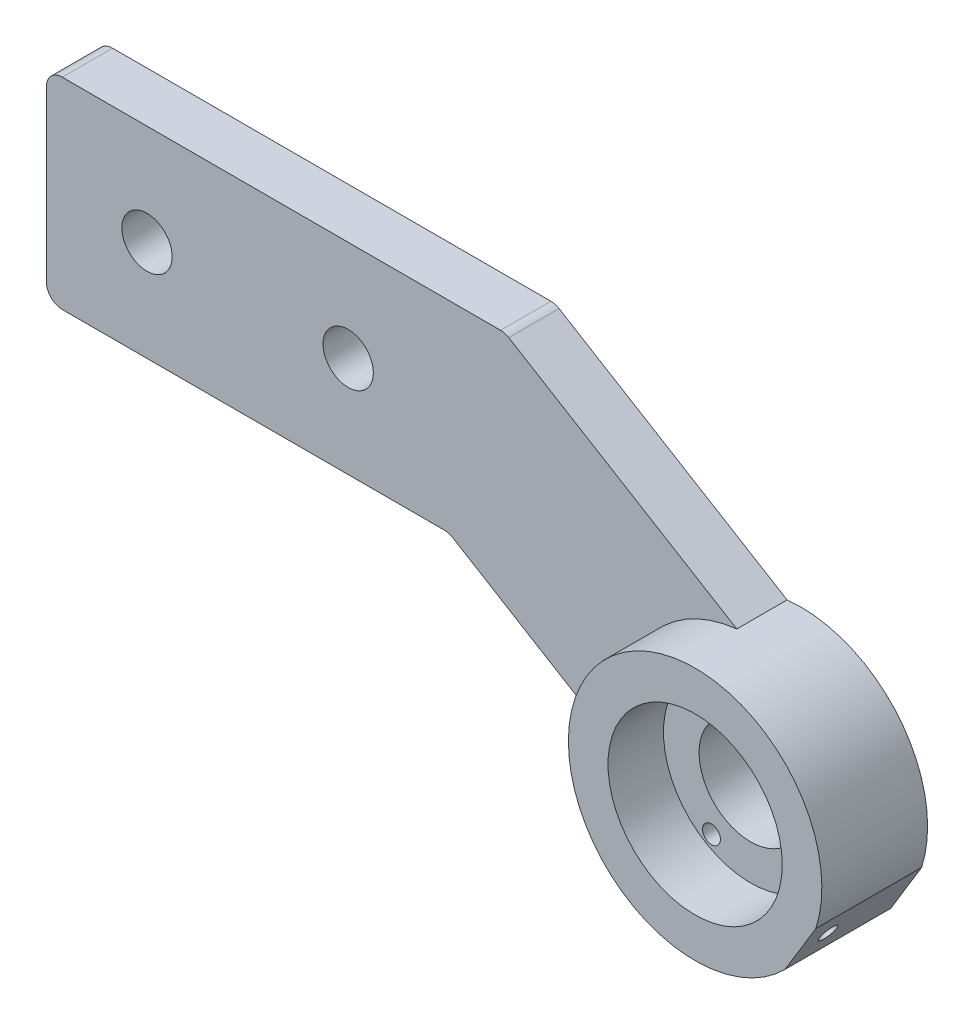
from build123d import *

# Parameters (mm, degrees)
SKETCH1_R               = 3.175
SKETCH1_R_2             = 6.5
SKETCH1_R_3             = 1.1303
BOSS_EXTRUDE1_DEPTH     = 6.35
FILLET3_R               = 2
SKETCH4_R               = 11
BOSS_EXTRUDE2_DEPTH     = 7
CUT_EXTRUDE1_REACH      = 112.192
CUT_EXTRUDE1_END_RADIUS = 11
SKETCH2_R               = 1.1303


with BuildPart() as part:
    # Sketch1 → Boss-Extrude1 (new body)
    with BuildSketch(Plane.XY):
        with BuildLine():
            Line((-38.1, -12.7), (-38.1, 12.7))
            Line((-38.1, 12.7), (19.799208724, 12.7))
            Line((19.799208724, 12.7), (49.063216326, -5.044542368))
            ThreePointArc((49.063216326, -5.044542368), (63.185378941, -10.82071629), (66.044603929, -25.808194216))
            Line((66.044603929, -25.808194216), (62.155933896, -32.221324916))
            ThreePointArc((62.155933896, -32.221324916), (47.544550454, -36.615313538), (35.893587146, -26.763678338))
            Line((35.893587146, -26.763678338), (12.7, -12.7))
            Line((12.7, -12.7), (-38.1, -12.7))
        make_face()
        with Locations((-25.4, 0)):
            Circle(SKETCH1_R, mode=Mode.SUBTRACT)
        Circle(SKETCH1_R, mode=Mode.SUBTRACT)
        with Locations((50.8, -20.95)):
            Circle(SKETCH1_R_2, mode=Mode.SUBTRACT)
        with Locations((55.738610942, -12.805324011)):
            Circle(SKETCH1_R_3, mode=Mode.SUBTRACT)
        with Locations((45.861389058, -29.094675989)):
            Circle(SKETCH1_R_3, mode=Mode.SUBTRACT)
    extrude(amount=BOSS_EXTRUDE1_DEPTH)

    # Fillet3
    fillet3_edges = [part.edges().sort_by_distance(p)[0] for p in [
        (-38.1, -12.7, 3.175),
        (-38.1, 12.7, 3.175),
        (19.799208724, 12.7, 3.175),
        (12.7, -12.7, 3.175),
    ]]
    fillet(fillet3_edges, radius=FILLET3_R)

    # Sketch4 → Boss-Extrude2 (add)
    with BuildSketch(Plane.XY.offset(6.35)):
        with BuildLine():
            Line((66.044603929, -25.808194216), (62.155933896, -32.221324916))
            ThreePointArc((62.155933896, -32.221324916), (37.118654507, -12.654170595), (66.044603929, -25.808194216))
        make_face()
        with Locations((50.8, -20.95)):
            Circle(SKETCH4_R, mode=Mode.SUBTRACT)
    extrude(amount=BOSS_EXTRUDE2_DEPTH)

    # Cut-Extrude1: up to this cylinder (the profile starts outside it)
    cut_extrude1_end = Plane(origin=(50.8, -20.95, 9.85), z_dir=(0, 0, -1)) * Cylinder(CUT_EXTRUDE1_END_RADIUS, 247.384, mode=Mode.PRIVATE)
    # Sketch2 → Cut-Extrude1 (cut, up to the surface)
    with BuildSketch(Plane(origin=(59.73186838, -36.21905392, 0), x_dir=(0, 0, -1), z_dir=(0.8550840932924629, -0.5184893377864258, 0)), mode=Mode.PRIVATE) as cut_extrude1_sk1:
        with Locations(Location((-9.85, 8.425246605, 0), (0, 0, 90))):
            Circle(SKETCH2_R)
    cut_extrude1_tool1 = extrude(cut_extrude1_sk1.sketch, amount=-CUT_EXTRUDE1_REACH, mode=Mode.PRIVATE) - cut_extrude1_end
    add(cut_extrude1_tool1.solids().sort_by_distance((64.100269, -29.01476, 9.85))[0], mode=Mode.SUBTRACT)


solid = part.part
